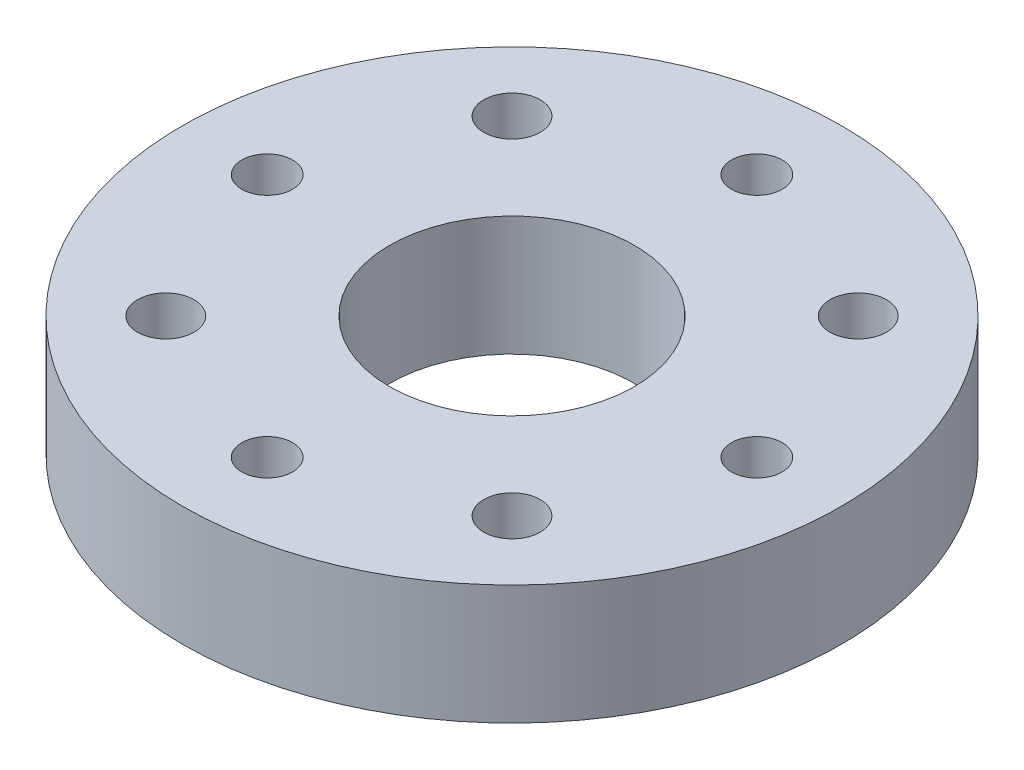
from build123d import *

# Parameters (mm, degrees)
SKETCH1_R           = 17.5
SKETCH1_R_2         = 6.5
SKETCH1_R_3         = 1.5
SKETCH1_R_4         = 1.35
BOSS_EXTRUDE1_DEPTH = 6.35


with BuildPart() as part:
    # Sketch1 → Boss-Extrude1 (new body)
    with BuildSketch(Plane(origin=(0, 0, 0), x_dir=(1, 0, 0), z_dir=(0, 1, 0))):
        with Locations(Location((0, 0, 0), (0, 0, 270))):
            Circle(SKETCH1_R)
        with Locations(Location((0, 0, 0), (0, 0, 270))):
            Circle(SKETCH1_R_2, mode=Mode.SUBTRACT)
        with Locations(Location((9.192388155, 9.192388155, 0), (0, 0, 270))):
            Circle(SKETCH1_R_3, mode=Mode.SUBTRACT)
        with Locations(Location((0, 13, 0), (0, 0, 270))):
            Circle(SKETCH1_R_4, mode=Mode.SUBTRACT)
        with Locations(Location((9.192388155, -9.192388155, 0), (0, 0, 270))):
            Circle(SKETCH1_R_3, mode=Mode.SUBTRACT)
        with Locations(Location((13, 0, 0), (0, 0, 270))):
            Circle(SKETCH1_R_4, mode=Mode.SUBTRACT)
        with Locations(Location((-9.192388155, -9.192388155, 0), (0, 0, 270))):
            Circle(SKETCH1_R_3, mode=Mode.SUBTRACT)
        with Locations(Location((0, -13, 0), (0, 0, 270))):
            Circle(SKETCH1_R_4, mode=Mode.SUBTRACT)
        with Locations(Location((-9.192388155, 9.192388155, 0), (0, 0, 270))):
            Circle(SKETCH1_R_3, mode=Mode.SUBTRACT)
        with Locations(Location((-13, 0, 0), (0, 0, 270))):
            Circle(SKETCH1_R_4, mode=Mode.SUBTRACT)
    extrude(amount=BOSS_EXTRUDE1_DEPTH)


solid = part.part
